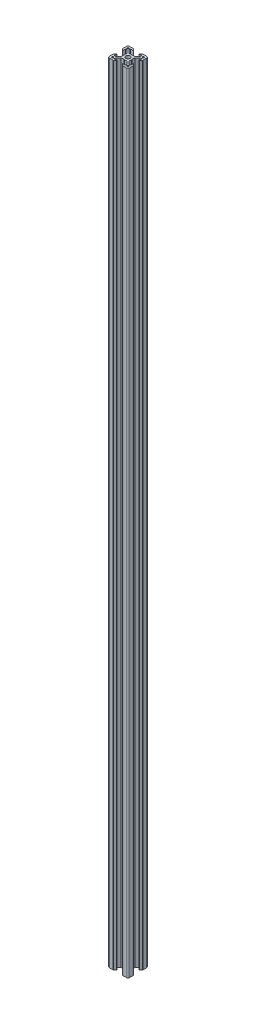
from build123d import *

# Parameters (mm, degrees)
SKETCH5_R           = 2.1
BOSS_EXTRUDE4_DEPTH = 780


with BuildPart() as part:
    # Sketch5 → Boss-Extrude4 (new body)
    with BuildSketch(Plane(origin=(0, 680, 0), x_dir=(1, 0, 0), z_dir=(0, 1, 0))):
        with BuildLine():
            Line((10.933291631, -2.510964723), (13.546664665, -2.510964723))
            Line((13.546664665, -2.510964723), (13.546664665, -4.150304529))
            Line((13.546664665, -4.150304529), (10.886004292, -6.810964917))
            Line((10.886004292, -6.810964917), (8.251433769, -6.810964917))
            Line((8.251433769, -6.810964917), (8.046664548, -7.015734138))
            Line((8.046664548, -7.015734138), (7.841895327, -6.810964917))
            Line((7.841895327, -6.810964917), (5.20732467, -6.810964917))
            Line((5.20732467, -6.810964917), (2.546664606, -4.150304933))
            Line((2.546664606, -4.150304933), (2.546664606, -2.510964723))
            Line((2.546664606, -2.510964723), (5.160037847, -2.510964723))
            Line((5.160037847, -2.510964723), (5.160037847, -2.404337587))
            Line((5.160037847, -2.404337587), (3.644466263, -0.888765902))
            ThreePointArc((3.644466263, -0.888765902), (3.447524808, -0.757173822), (3.215216519, -0.710964828))
            Line((3.215216519, -0.710964828), (-0.453335301, -0.710964828))
            ThreePointArc((-0.453335301, -0.710964828), (-1.51399556, -1.150304692), (-1.953335424, -2.210964951))
            Line((-1.953335424, -2.210964951), (-1.953335424, -5.810965145))
            ThreePointArc((-1.953335424, -5.810965145), (-1.920400619, -6.079855092), (-1.775534246, -6.308766076))
            Line((-1.775534246, -6.308766076), (-0.259962261, -7.82433806))
            Line((-0.259962261, -7.82433806), (-0.153335306, -7.82433806))
            Line((-0.153335306, -7.82433806), (-0.153335306, -5.210964844))
            Line((-0.153335306, -5.210964844), (1.48600445, -5.210964844))
            Line((1.48600445, -5.210964844), (4.146664635, -7.871625029))
            Line((4.146664635, -7.871625029), (4.146664635, -10.511096803))
            Line((4.146664635, -10.511096803), (4.346532653, -10.71096482))
            Line((4.346532653, -10.71096482), (4.146664635, -10.910832837))
            Line((4.146664635, -10.910832837), (4.146664635, -13.550304611))
            Line((4.146664635, -13.550304611), (1.486004498, -16.210964763))
            Line((1.486004498, -16.210964763), (-0.153335306, -16.210964763))
            Line((-0.153335306, -16.210964763), (-0.153335306, -13.597591958))
            Line((-0.153335306, -13.597591958), (-0.259962405, -13.597591958))
            Line((-0.259962405, -13.597591958), (-1.775534389, -15.113163943))
            ThreePointArc((-1.775534389, -15.113163943), (-1.907551313, -15.346664458), (-1.953335424, -15.610964996))
            Line((-1.953335424, -15.610964996), (-1.953335424, -19.210964568))
            ThreePointArc((-1.953335424, -19.210964568), (-1.513995592, -20.27162475), (-0.453335411, -20.710964582))
            Line((-0.453335411, -20.710964582), (3.215216577, -20.710964582))
            ThreePointArc((3.215216577, -20.710964582), (3.447524814, -20.6647556), (3.644466229, -20.533163554))
            Line((3.644466229, -20.533163554), (5.160037847, -19.017591936))
            Line((5.160037847, -19.017591936), (5.160037847, -18.910964955))
            Line((5.160037847, -18.910964955), (2.546664606, -18.910964955))
            Line((2.546664606, -18.910964955), (2.546664606, -17.271624993))
            Line((2.546664606, -17.271624993), (5.207324725, -14.610964873))
            Line((5.207324725, -14.610964873), (7.839690462, -14.610964873))
            Line((7.839690462, -14.610964873), (8.046664589, -14.406195535))
            Line((8.046664589, -14.406195535), (8.251433823, -14.610964873))
            Line((8.251433823, -14.610964873), (10.88600448, -14.610964873))
            Line((10.88600448, -14.610964873), (13.546664665, -17.271625059))
            Line((13.546664665, -17.271625059), (13.546664665, -18.910964955))
            Line((13.546664665, -18.910964955), (10.933291631, -18.910964955))
            Line((10.933291631, -18.910964955), (10.933291631, -19.017591953))
            Line((10.933291631, -19.017591953), (12.448863173, -20.533163494))
            ThreePointArc((12.448863173, -20.533163494), (12.645804654, -20.664755585), (12.878112969, -20.710964582))
            Line((12.878112969, -20.710964582), (16.546664468, -20.710964582))
            ThreePointArc((16.546664468, -20.710964582), (17.607324734, -20.271624715), (18.046664601, -19.210964449))
            Line((18.046664601, -19.210964449), (18.046664601, -15.542413801))
            ThreePointArc((18.046664601, -15.542413801), (18.000455626, -15.310105584), (17.868863597, -15.113164184))
            Line((17.868863597, -15.113164184), (16.353291472, -13.597591958))
            Line((16.353291472, -13.597591958), (16.246664762, -13.597591958))
            Line((16.246664762, -13.597591958), (16.246664762, -16.210964763))
            Line((16.246664762, -16.210964763), (14.607324803, -16.210964763))
            Line((14.607324803, -16.210964763), (11.94666457, -13.550304611))
            Line((11.94666457, -13.550304611), (11.94666457, -10.910832837))
            Line((11.94666457, -10.910832837), (11.746796552, -10.71096482))
            Line((11.746796552, -10.71096482), (11.94666457, -10.511096803))
            Line((11.94666457, -10.511096803), (11.94666457, -7.871625029))
            Line((11.94666457, -7.871625029), (14.607324755, -5.210964844))
            Line((14.607324755, -5.210964844), (16.246664762, -5.210964844))
            Line((16.246664762, -5.210964844), (16.246664762, -7.82433806))
            Line((16.246664762, -7.82433806), (16.353291723, -7.82433806))
            Line((16.353291723, -7.82433806), (17.868863593, -6.30876619))
            ThreePointArc((17.868863593, -6.30876619), (18.000455625, -6.111824797), (18.046664601, -5.879516585))
            Line((18.046664601, -5.879516585), (18.046664601, -2.210964977))
            ThreePointArc((18.046664601, -2.210964977), (17.60732473, -1.1503047), (16.546664453, -0.710964828))
            Line((16.546664453, -0.710964828), (12.87811338, -0.710964828))
            ThreePointArc((12.87811338, -0.710964828), (12.645805115, -0.757173815), (12.448863677, -0.888765877))
            Line((12.448863677, -0.888765877), (10.933291631, -2.404337922))
            Line((10.933291631, -2.404337922), (10.933291631, -2.510964723))
        make_face()
        with Locations(Location((8.046664646, -10.71096484, 0), (0, 0, 270))):
            Circle(SKETCH5_R, mode=Mode.SUBTRACT)
        Polygon((15.704247289, -4.138217153), (16.246664762, -4.138217153), (16.246664762, -2.510964723), (14.619412332, -2.510964723), (14.619412332, -3.053382543), align=None, mode=Mode.SUBTRACT)
        Polygon((16.246664762, -18.910964955), (16.246664762, -17.283712525), (15.704247289, -17.283712525), (14.619412332, -18.368547483), (14.619412332, -18.910964955), align=None, mode=Mode.SUBTRACT)
        Polygon((1.473917132, -3.053382195), (1.473917132, -2.510964723), (-0.153335306, -2.510964723), (-0.153335306, -4.138217153), (0.389082175, -4.138217153), align=None, mode=Mode.SUBTRACT)
        Polygon((1.473917132, -18.910964955), (1.473917132, -18.368547483), (0.389082175, -17.283712525), (-0.153335306, -17.283712525), (-0.153335306, -18.910964955), align=None, mode=Mode.SUBTRACT)
    extrude(amount=-BOSS_EXTRUDE4_DEPTH)


solid = part.part
